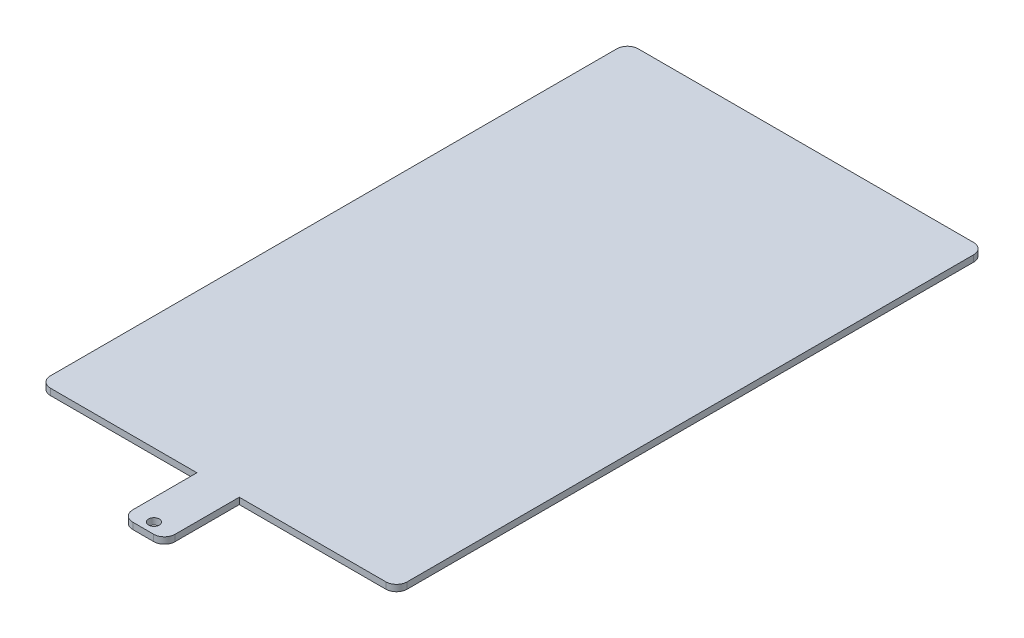
from build123d import *

# Parameters (mm, degrees)
BOSS_EXTRUDE1_DEPTH = 3
SKETCH2_R           = 2.5
CUT_EXTRUDE1_DEPTH  = 5
FILLET1_R           = 5


with BuildPart() as part:
    # Sketch1 → Boss-Extrude1 (new body)
    with BuildSketch(Plane(origin=(0, 0, 0), x_dir=(1, 0, 0), z_dir=(0, 1, 0))):
        Polygon((0, 0), (73.5, 0), (73.5, -35), (93.3, -35), (93.3, 0), (166.8, 0), (166.8, 274.8), (0, 274.8), align=None)
    extrude(amount=BOSS_EXTRUDE1_DEPTH)

    # Sketch2 → Cut-Extrude1 (cut)
    with BuildSketch(Plane(origin=(0, 3, 0), x_dir=(1, 0, 0), z_dir=(0, 1, 0))):
        with Locations(Location((83.4, -30, 0), (0, 0, 270))):
            Circle(SKETCH2_R)
    extrude(amount=-CUT_EXTRUDE1_DEPTH, mode=Mode.SUBTRACT)

    # Fillet1
    fillet1_edges = [part.edges().sort_by_distance(p)[0] for p in [
        (0, 1.5, -274.8),
        (166.8, 1.5, -274.8),
        (166.8, 1.5, 0),
        (93.3, 1.5, 35),
        (73.5, 1.5, 35),
        (0, 1.5, 0),
    ]]
    fillet(fillet1_edges, radius=FILLET1_R)


solid = part.part
